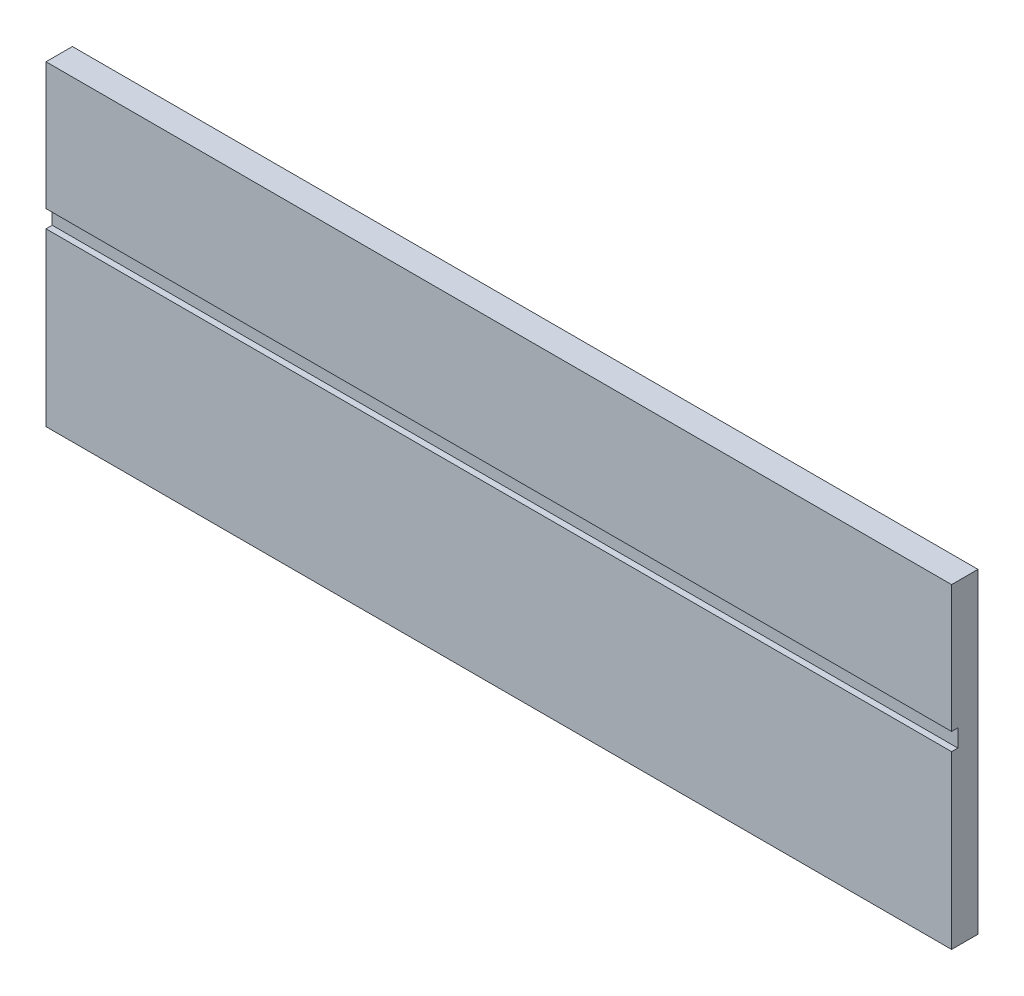
from build123d import *

# Parameters (mm, degrees)
SKETCH2_W          = 740.41
SKETCH2_H          = 258.3688
EXTRUDE1_DEPTH     = 21.59
SKETCH3_W          = 740.41
SKETCH3_H          = 14.3002
CUT_EXTRUDE1_DEPTH = 5.08


with BuildPart() as part:
    # Sketch2 → Extrude1 (new body)
    with BuildSketch(Plane.XY):
        with Locations((-233.045, -5665.1906)):
            Rectangle(SKETCH2_W, SKETCH2_H)
    extrude(amount=-EXTRUDE1_DEPTH)

    # Sketch3 → Cut-Extrude1 (cut)
    with BuildSketch(Plane.XY):
        with Locations((-233.045, -5647.1439)):
            Rectangle(SKETCH3_W, SKETCH3_H)
    extrude(amount=-CUT_EXTRUDE1_DEPTH, mode=Mode.SUBTRACT)


solid = part.part
